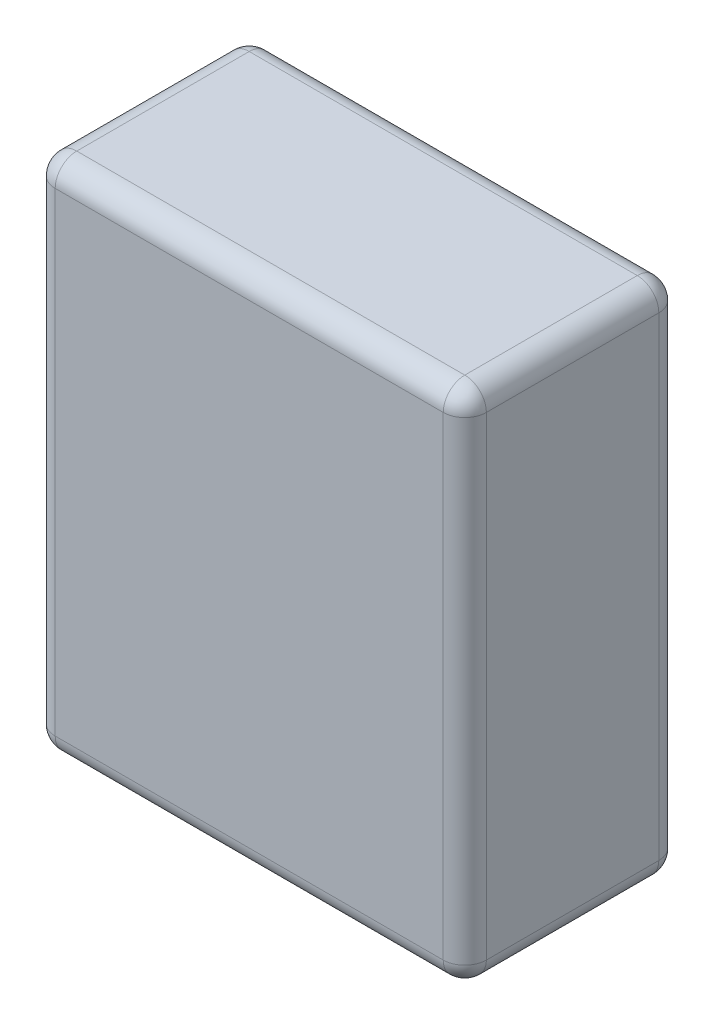
from build123d import *

# Parameters (mm, degrees)
SKETCH_1_W      = 10
SKETCH_1_H      = 12
EXTRUDE_1_DEPTH = 5
FILLET_1_R      = 0.5


with BuildPart() as part:
    # ｽｹｯﾁ1 → ﾎﾞｽ - 押し出し1 (new body)
    with BuildSketch(Plane.XY):
        Rectangle(SKETCH_1_W, SKETCH_1_H)
    extrude(amount=EXTRUDE_1_DEPTH)

    # ﾌｨﾚｯﾄ1
    fillet_1_edges = [part.edges().sort_by_distance(p)[0] for p in [
        (-5, 0, 5),
        (0, -6, 5),
        (5, 0, 5),
        (0, -6, 0),
        (-5, 0, 0),
        (0, 6, 0),
        (5, 0, 0),
        (5, -6, 2.5),
        (-5, -6, 2.5),
        (-5, 6, 2.5),
        (5, 6, 2.5),
        (0, 6, 5),
    ]]
    fillet(fillet_1_edges, radius=FILLET_1_R)


solid = part.part
